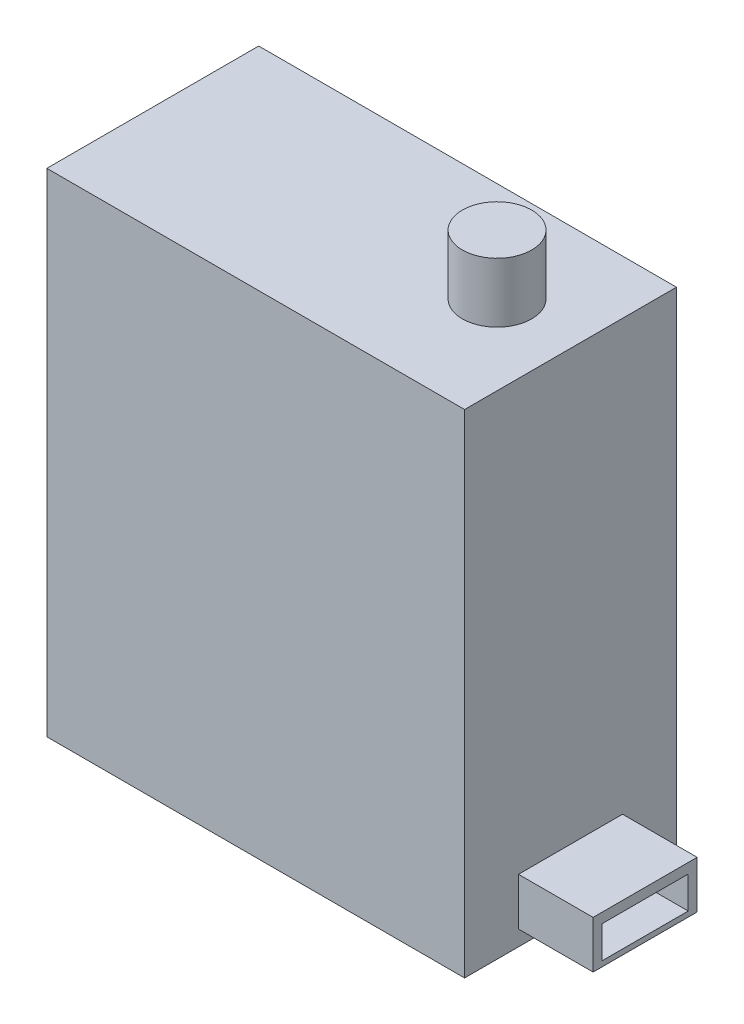
from build123d import *

# Parameters (mm, degrees)
SKETCH1_W           = 28
SKETCH1_H           = 14.2
BOSS_EXTRUDE1_DEPTH = 33
SKETCH2_R           = 2.321908149
BOSS_EXTRUDE3_DEPTH = 4
SKETCH3_W           = 6.974752534
SKETCH3_H           = 3.176308394
BOSS_EXTRUDE4_DEPTH = 5
SKETCH4_W           = 5.77752576
SKETCH4_H           = 2.149777027
CUT_EXTRUDE1_DEPTH  = 5


with BuildPart() as part:
    # Sketch1 → Boss-Extrude1 (new body)
    with BuildSketch(Plane(origin=(0, 0, 0), x_dir=(1, 0, 0), z_dir=(0, 1, 0))):
        with Locations((-14, 7.1)):
            Rectangle(SKETCH1_W, SKETCH1_H)
    extrude(amount=BOSS_EXTRUDE1_DEPTH)

    # Sketch2 → Boss-Extrude3 (add)
    with BuildSketch(Plane(origin=(0, 33, 0), x_dir=(1, 0, 0), z_dir=(0, 1, 0))):
        with Locations(Location((-5.331542912, 7.506333926, 0), (0, 0, 270))):
            Circle(SKETCH2_R)
    extrude(amount=BOSS_EXTRUDE3_DEPTH)

    # Sketch3 → Boss-Extrude4 (add)
    with BuildSketch(Plane(origin=(0, 0, 0), x_dir=(0, 0, -1), z_dir=(1, 0, 0))):
        with Locations((7.1, 2.624490745)):
            Rectangle(SKETCH3_W, SKETCH3_H)
    extrude(amount=BOSS_EXTRUDE4_DEPTH)

    # Sketch4 → Cut-Extrude1 (cut)
    with BuildSketch(Plane(origin=(5, 0, 0), x_dir=(0, 0, -1), z_dir=(1, 0, 0))):
        with Locations((7.1, 2.467865933)):
            Rectangle(SKETCH4_W, SKETCH4_H)
    extrude(amount=-CUT_EXTRUDE1_DEPTH, mode=Mode.SUBTRACT)


solid = part.part
